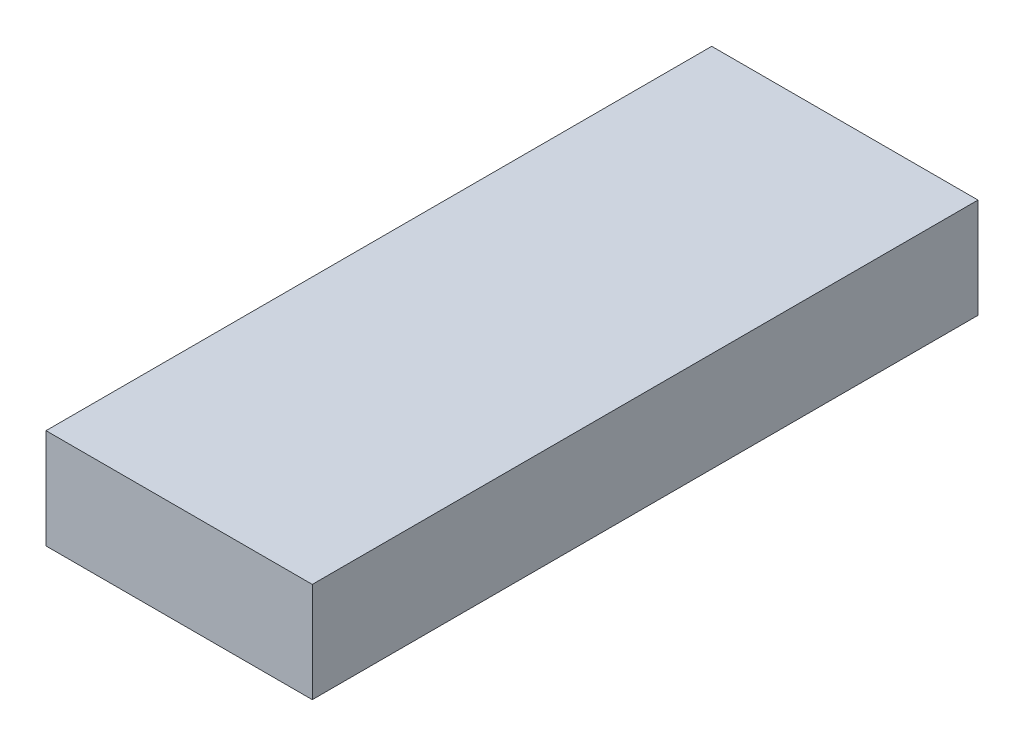
from build123d import *

# Parameters (mm, degrees)
SKETCH1_W           = 20.32
SKETCH1_H           = 7.62
BOSS_EXTRUDE1_DEPTH = 50.8


with BuildPart() as part:
    # Sketch1 → Boss-Extrude1 (new body)
    with BuildSketch(Plane.XY):
        with Locations((-10.16, 3.81)):
            Rectangle(SKETCH1_W, SKETCH1_H)
    extrude(amount=BOSS_EXTRUDE1_DEPTH)


solid = part.part
